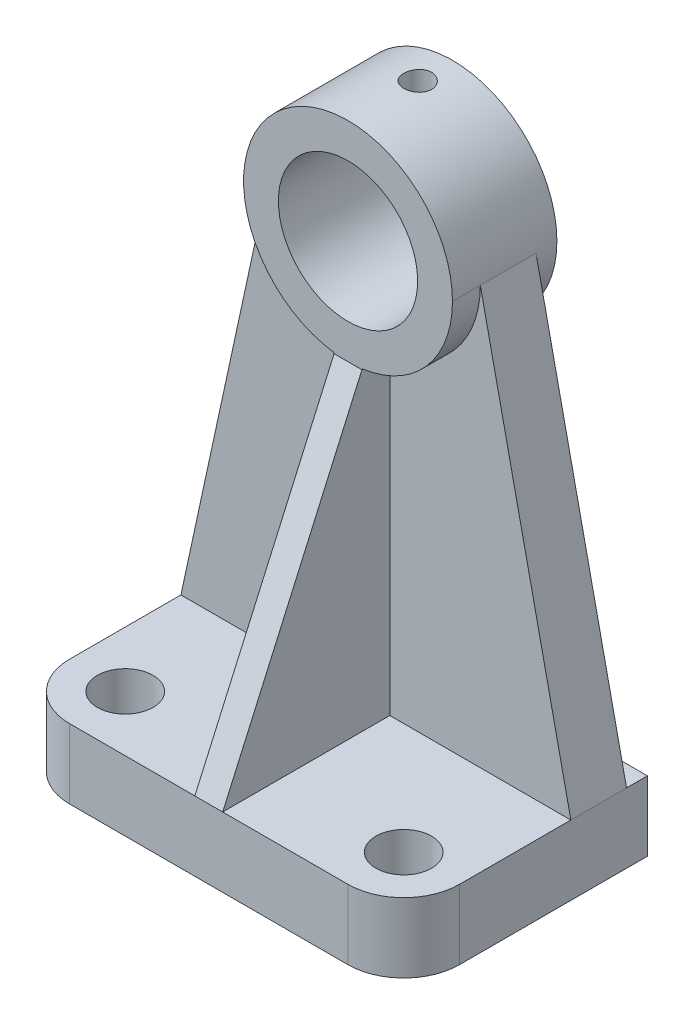
from build123d import *

# Parameters (mm, degrees)
IZIM1_R                      = 40
Y_KSEKLIK_EKSTR_ZYON1_DEPTH  = 100
IZIM2_R                      = 150
IZIM2_R_2                    = 100
Y_KSEKLIK_EKSTR_ZYON2_DEPTH  = 150
Y_KSEKLIK_EKSTR_ZYON3_DEPTH  = 80
IZIM6_R                      = 20
KES_EKSTR_ZYON1_DEPTH        = 927.606712689
Y_KSEKLIK_EKSTR_ZYON11_DEPTH = 20
Y_KSEKLIK_EKSTR_ZYON12_REACH = 861.418
IZIM8_W                      = 40
IZIM8_H                      = 40


with BuildPart() as part:
    # Çizim1 → Yükseklik-Ekstrüzyon1 (new body)
    with BuildSketch(Plane(origin=(0, 0, 0), x_dir=(1, 0, 0), z_dir=(0, 1, 0))):
        with BuildLine():
            Line((0, 0), (560, 0))
            Line((560, 0), (560, -270))
            ThreePointArc((560, -270), (536.568542495, -326.568542495), (480, -350))
            Line((480, -350), (80, -350))
            ThreePointArc((80, -350), (23.431457505, -326.568542495), (0, -270))
            Line((0, -270), (0, 0))
        make_face()
        with Locations(Location((80, -270, 0), (0, 0, 270))):
            Circle(IZIM1_R, mode=Mode.SUBTRACT)
        with Locations(Location((480, -270, 0), (0, 0, 270))):
            Circle(IZIM1_R, mode=Mode.SUBTRACT)
    extrude(amount=Y_KSEKLIK_EKSTR_ZYON1_DEPTH)



with BuildPart() as body_2:
    # Çizim2 → Yükseklik-Ekstrüzyon2 (new body)
    with BuildSketch(Plane.XY):
        with Locations((280, 700)):
            Circle(IZIM2_R)
        with Locations((280, 700)):
            Circle(IZIM2_R_2, mode=Mode.SUBTRACT)
    extrude(amount=Y_KSEKLIK_EKSTR_ZYON2_DEPTH)


with BuildPart() as part_1:
    add(part.part)

    add(body_2.part)  # Yükseklik-Ekstrüzyon3 merges body 2
    # Çizim5 → Yükseklik-Ekstrüzyon3 (add)
    with BuildSketch(Plane.XY.offset(30)):
        with BuildLine():
            Line((130, 700), (0, 100))
            Line((0, 100), (560, 100))
            Line((560, 100), (430, 700))
            ThreePointArc((430, 700), (280, 550), (130, 700))
        make_face()
    extrude(amount=Y_KSEKLIK_EKSTR_ZYON3_DEPTH)

    # Çizim6 → Kes-Ekstrüzyon1 (cut, through all)
    with BuildSketch(Plane(origin=(0, 650, 0), x_dir=(1, 0, 0), z_dir=(0, 1, 0))):
        with Locations(Location((280, -50, 0), (0, 0, 90))):
            Circle(IZIM6_R)
    extrude(amount=KES_EKSTR_ZYON1_DEPTH, mode=Mode.SUBTRACT)

    # Çizim8 → Yükseklik-Ekstrüzyon12 (add, up to next)
    with BuildSketch(Plane(origin=(0, 550, 0), x_dir=(1, 0, 0), z_dir=(0, 1, 0)), mode=Mode.PRIVATE) as y_kseklik_ekstr_zyon12_sk1:
        with Locations((280, -130)):
            Rectangle(IZIM8_W, IZIM8_H)
    y_kseklik_ekstr_zyon12_tool1 = extrude(y_kseklik_ekstr_zyon12_sk1.sketch, amount=Y_KSEKLIK_EKSTR_ZYON12_REACH, mode=Mode.PRIVATE) - part_1.part


with BuildPart() as body_2_2:
    # Çizim7 → Yükseklik-Ekstrüzyon11 (new, symmetric)
    with BuildSketch(Plane(origin=(280, 0, 0), x_dir=(0, 0, -1), z_dir=(1, 0, 0))):
        Polygon((-350, 100), (-150, 550), (-110, 550), (-110, 100), align=None)
    extrude(amount=Y_KSEKLIK_EKSTR_ZYON11_DEPTH, both=True)


with BuildPart() as part_2:
    add(part_1.part)

    add(body_2_2.part)  # Yükseklik-Ekstrüzyon12 merges body 2 2
    add(y_kseklik_ekstr_zyon12_tool1.solids().sort_by_distance((280, 550, 130))[0])
    add(y_kseklik_ekstr_zyon12_tool1.solids().sort_by_distance((280, 550, 130))[1])


solid = part_2.part
